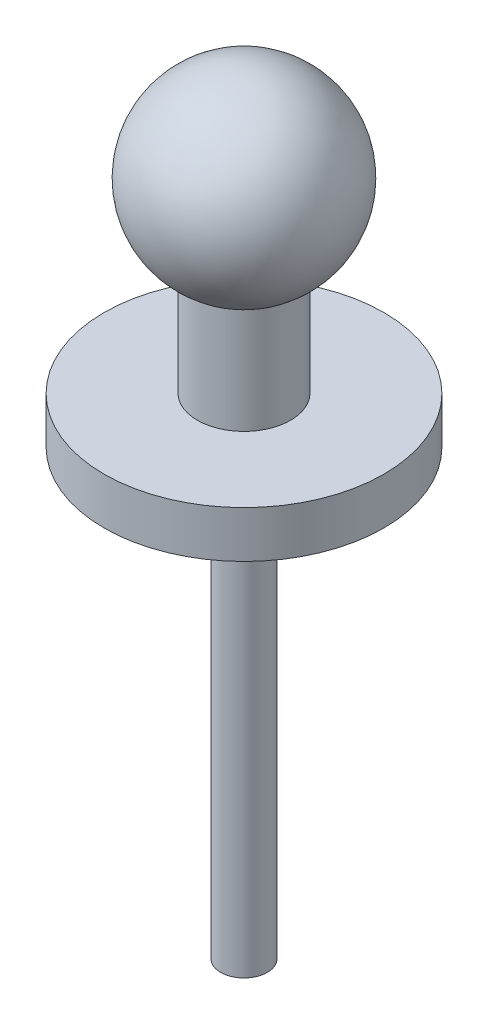
from build123d import *

# Parameters (mm, degrees)
SKETCH7_R           = 1
BOSS_EXTRUDE1_DEPTH = 19
SKETCH8_R           = 6
BOSS_EXTRUDE2_DEPTH = 2
SKETCH9_R           = 2
BOSS_EXTRUDE3_DEPTH = 5


with BuildPart() as part:
    # Sketch7 → Boss-Extrude1 (new body)
    with BuildSketch(Plane(origin=(0, 24, 0), x_dir=(1, 0, 0), z_dir=(0, 1, 0))):
        with Locations(Location((0, 0, 0), (0, 0, 270))):
            Circle(SKETCH7_R)
    extrude(amount=BOSS_EXTRUDE1_DEPTH)

    # Sketch8 → Boss-Extrude2 (add)
    with BuildSketch(Plane(origin=(0, 43, 0), x_dir=(1, 0, 0), z_dir=(0, 1, 0))):
        with Locations(Location((0, 0, 0), (0, 0, 270))):
            Circle(SKETCH8_R)
    extrude(amount=BOSS_EXTRUDE2_DEPTH)

    # Sketch9 → Boss-Extrude3 (add)
    with BuildSketch(Plane(origin=(0, 45, 0), x_dir=(1, 0, 0), z_dir=(0, 1, 0))):
        with Locations(Location((0, 0, 0), (0, 0, 270))):
            Circle(SKETCH9_R)
    extrude(amount=BOSS_EXTRUDE3_DEPTH)

    # Sketch6 → Revolve1 (revolve)
    with BuildSketch(Plane(origin=(0, 53, 0), x_dir=(1, 0, 0), z_dir=(0, 1, 0))):
        with BuildLine():
            Line((-4, 0), (4, 0))
            ThreePointArc((4, 0), (0, 4), (-4, 0))
        make_face()
    revolve(axis=Axis((-4, 53, 0), (1, 0, 0)))


solid = part.part
